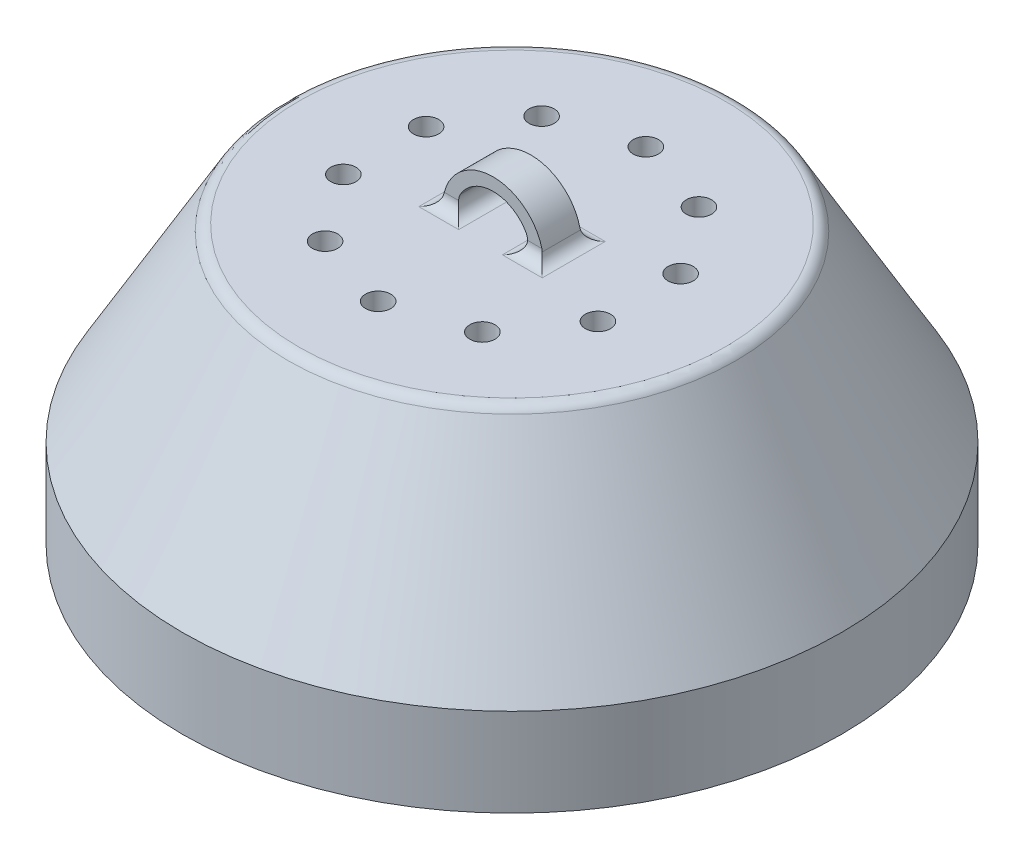
from build123d import *

# Parameters (mm, degrees)
SKETCH1_R           = 26.15
SKETCH1_R_2         = 24.75
BOSS_EXTRUDE1_DEPTH = 7
SKETCH3_R           = 26.15
BOSS_EXTRUDE2_DEPTH = 15
BOSS_EXTRUDE2_TAPER = 30
SKETCH4_R           = 24.75
CUT_EXTRUDE1_DEPTH  = 13.5
CUT_EXTRUDE1_DRAFT  = -30
BOSS_EXTRUDE4_DEPTH = 1.5
FILLET2_R           = 1
CUT_EXTRUDE2_REACH  = 45.031
SKETCH6_R           = 1


with BuildPart() as part:
    # Sketch1 → Boss-Extrude1 (new body)
    with BuildSketch(Plane(origin=(0, 0, 0), x_dir=(1, 0, 0), z_dir=(0, 1, 0))):
        with Locations(Location((0, 0, 0), (0, 0, 270))):
            Circle(SKETCH1_R)
        with Locations(Location((0, 0, 0), (0, 0, 270))):
            Circle(SKETCH1_R_2, mode=Mode.SUBTRACT)
    extrude(amount=BOSS_EXTRUDE1_DEPTH)

    # Sketch3 → Boss-Extrude2 (add)
    with BuildSketch(Plane(origin=(0, 7, 0), x_dir=(1, 0, 0), z_dir=(0, 1, 0))):
        with Locations(Location((0, 0, 0), (0, 0, 270))):
            Circle(SKETCH3_R)
    extrude(amount=BOSS_EXTRUDE2_DEPTH, taper=BOSS_EXTRUDE2_TAPER)


with BuildPart() as cut_extrude1_tool:
    # Sketch4 → Cut-Extrude1 (with draft: the straight prism first)
    with BuildSketch(Plane.XZ.offset(-7)):
        with Locations(Location((0, 0, 0), (0, 0, 270))):
            Circle(SKETCH4_R)
    extrude(amount=-CUT_EXTRUDE1_DEPTH)
    # Cut-Extrude1: the draft: its side faces are tilted about the plane it starts from
    cut_extrude1_sides = [cut_extrude1_tool.faces().sort_by_distance(p)[0] for p in [
        (0, 13.75, 24.75),
    ]]
    draft(cut_extrude1_sides, Plane.XZ.offset(-7), CUT_EXTRUDE1_DRAFT)


with BuildPart() as part_1:
    add(part.part)

    # Cut-Extrude1: cut by cut_extrude1_tool
    add(cut_extrude1_tool.part, mode=Mode.SUBTRACT)

    # Sketch5 → Boss-Extrude4 (add, symmetric)
    with BuildSketch(Plane.XY):
        with BuildLine():
            Line((-4, 22), (-3, 22))
            ThreePointArc((-3, 22), (0, 25), (3, 22))
            Line((3, 22), (4, 22))
            ThreePointArc((4, 22), (0, 26), (-4, 22))
        make_face()
    extrude(amount=BOSS_EXTRUDE4_DEPTH, both=True)

    # Fillet2
    fillet2_edges = [part_1.edges().sort_by_distance(p)[0] for p in [
        (4, 22, 0),
        (-3.5, 22, -1.5),
        (-4, 22, 0),
        (-3, 22, 0),
        (3.5, 22, -1.5),
        (3, 22, 0),
        (-3.5, 22, 1.5),
        (3.5, 22, 1.5),
        (0, 0, -24.75),
        (0, 22, -17.489745962),
    ]]
    fillet(fillet2_edges, radius=FILLET2_R)

    # Sketch6 → Cut-Extrude2 (cut, up to next)
    with BuildSketch(Plane(origin=(0, 22, 0), x_dir=(1, 0, 0), z_dir=(0, 1, 0)), mode=Mode.PRIVATE) as cut_extrude2_sk1:
        with Locations(Location((0, 10.620343227, 0), (0, 0, 270))):
            Circle(SKETCH6_R)
    cut_extrude2_tool1 = extrude(cut_extrude2_sk1.sketch, amount=-CUT_EXTRUDE2_REACH, mode=Mode.PRIVATE) & part_1.part
    # Sketch6 → Cut-Extrude2 (cut, up to next)
    with BuildSketch(Plane(origin=(0, 22, 0), x_dir=(1, 0, 0), z_dir=(0, 1, 0)), mode=Mode.PRIVATE) as cut_extrude2_sk2:
        with Locations(Location((6.242481123, 8.592038157, 0), (0, 0, 270))):
            Circle(SKETCH6_R)
    cut_extrude2_tool2 = extrude(cut_extrude2_sk2.sketch, amount=-CUT_EXTRUDE2_REACH, mode=Mode.PRIVATE) & part_1.part
    # Sketch6 → Cut-Extrude2 (cut, up to next)
    with BuildSketch(Plane(origin=(0, 22, 0), x_dir=(1, 0, 0), z_dir=(0, 1, 0)), mode=Mode.PRIVATE) as cut_extrude2_sk3:
        with Locations(Location((10.100546631, 3.281866543, 0), (0, 0, 270))):
            Circle(SKETCH6_R)
    cut_extrude2_tool3 = extrude(cut_extrude2_sk3.sketch, amount=-CUT_EXTRUDE2_REACH, mode=Mode.PRIVATE) & part_1.part
    # Sketch6 → Cut-Extrude2 (cut, up to next)
    with BuildSketch(Plane(origin=(0, 22, 0), x_dir=(1, 0, 0), z_dir=(0, 1, 0)), mode=Mode.PRIVATE) as cut_extrude2_sk4:
        with Locations(Location((10.100546631, -3.281866543, 0), (0, 0, 270))):
            Circle(SKETCH6_R)
    cut_extrude2_tool4 = extrude(cut_extrude2_sk4.sketch, amount=-CUT_EXTRUDE2_REACH, mode=Mode.PRIVATE) & part_1.part
    # Sketch6 → Cut-Extrude2 (cut, up to next)
    with BuildSketch(Plane(origin=(0, 22, 0), x_dir=(1, 0, 0), z_dir=(0, 1, 0)), mode=Mode.PRIVATE) as cut_extrude2_sk5:
        with Locations(Location((6.242481123, -8.592038157, 0), (0, 0, 270))):
            Circle(SKETCH6_R)
    cut_extrude2_tool5 = extrude(cut_extrude2_sk5.sketch, amount=-CUT_EXTRUDE2_REACH, mode=Mode.PRIVATE) & part_1.part
    # Sketch6 → Cut-Extrude2 (cut, up to next)
    with BuildSketch(Plane(origin=(0, 22, 0), x_dir=(1, 0, 0), z_dir=(0, 1, 0)), mode=Mode.PRIVATE) as cut_extrude2_sk6:
        with Locations(Location((0, -10.620343227, 0), (0, 0, 270))):
            Circle(SKETCH6_R)
    cut_extrude2_tool6 = extrude(cut_extrude2_sk6.sketch, amount=-CUT_EXTRUDE2_REACH, mode=Mode.PRIVATE) & part_1.part
    # Sketch6 → Cut-Extrude2 (cut, up to next)
    with BuildSketch(Plane(origin=(0, 22, 0), x_dir=(1, 0, 0), z_dir=(0, 1, 0)), mode=Mode.PRIVATE) as cut_extrude2_sk7:
        with Locations(Location((-6.242481123, -8.592038157, 0), (0, 0, 270))):
            Circle(SKETCH6_R)
    cut_extrude2_tool7 = extrude(cut_extrude2_sk7.sketch, amount=-CUT_EXTRUDE2_REACH, mode=Mode.PRIVATE) & part_1.part
    # Sketch6 → Cut-Extrude2 (cut, up to next)
    with BuildSketch(Plane(origin=(0, 22, 0), x_dir=(1, 0, 0), z_dir=(0, 1, 0)), mode=Mode.PRIVATE) as cut_extrude2_sk8:
        with Locations(Location((-10.100546631, -3.281866543, 0), (0, 0, 270))):
            Circle(SKETCH6_R)
    cut_extrude2_tool8 = extrude(cut_extrude2_sk8.sketch, amount=-CUT_EXTRUDE2_REACH, mode=Mode.PRIVATE) & part_1.part
    # Sketch6 → Cut-Extrude2 (cut, up to next)
    with BuildSketch(Plane(origin=(0, 22, 0), x_dir=(1, 0, 0), z_dir=(0, 1, 0)), mode=Mode.PRIVATE) as cut_extrude2_sk9:
        with Locations(Location((-10.100546631, 3.281866543, 0), (0, 0, 270))):
            Circle(SKETCH6_R)
    cut_extrude2_tool9 = extrude(cut_extrude2_sk9.sketch, amount=-CUT_EXTRUDE2_REACH, mode=Mode.PRIVATE) & part_1.part
    # Sketch6 → Cut-Extrude2 (cut, up to next)
    with BuildSketch(Plane(origin=(0, 22, 0), x_dir=(1, 0, 0), z_dir=(0, 1, 0)), mode=Mode.PRIVATE) as cut_extrude2_sk10:
        with Locations(Location((-6.242481123, 8.592038157, 0), (0, 0, 270))):
            Circle(SKETCH6_R)
    cut_extrude2_tool10 = extrude(cut_extrude2_sk10.sketch, amount=-CUT_EXTRUDE2_REACH, mode=Mode.PRIVATE) & part_1.part
    add(cut_extrude2_tool1.solids().sort_by_distance((0, 22, -10.620343))[0], mode=Mode.SUBTRACT)
    add(cut_extrude2_tool2.solids().sort_by_distance((6.242481, 22, -8.592038))[0], mode=Mode.SUBTRACT)
    add(cut_extrude2_tool3.solids().sort_by_distance((10.100547, 22, -3.281867))[0], mode=Mode.SUBTRACT)
    add(cut_extrude2_tool4.solids().sort_by_distance((10.100547, 22, 3.281867))[0], mode=Mode.SUBTRACT)
    add(cut_extrude2_tool5.solids().sort_by_distance((6.242481, 22, 8.592038))[0], mode=Mode.SUBTRACT)
    add(cut_extrude2_tool6.solids().sort_by_distance((0, 22, 10.620343))[0], mode=Mode.SUBTRACT)
    add(cut_extrude2_tool7.solids().sort_by_distance((-6.242481, 22, 8.592038))[0], mode=Mode.SUBTRACT)
    add(cut_extrude2_tool8.solids().sort_by_distance((-10.100547, 22, 3.281867))[0], mode=Mode.SUBTRACT)
    add(cut_extrude2_tool9.solids().sort_by_distance((-10.100547, 22, -3.281867))[0], mode=Mode.SUBTRACT)
    add(cut_extrude2_tool10.solids().sort_by_distance((-6.242481, 22, -8.592038))[0], mode=Mode.SUBTRACT)


solid = part_1.part
